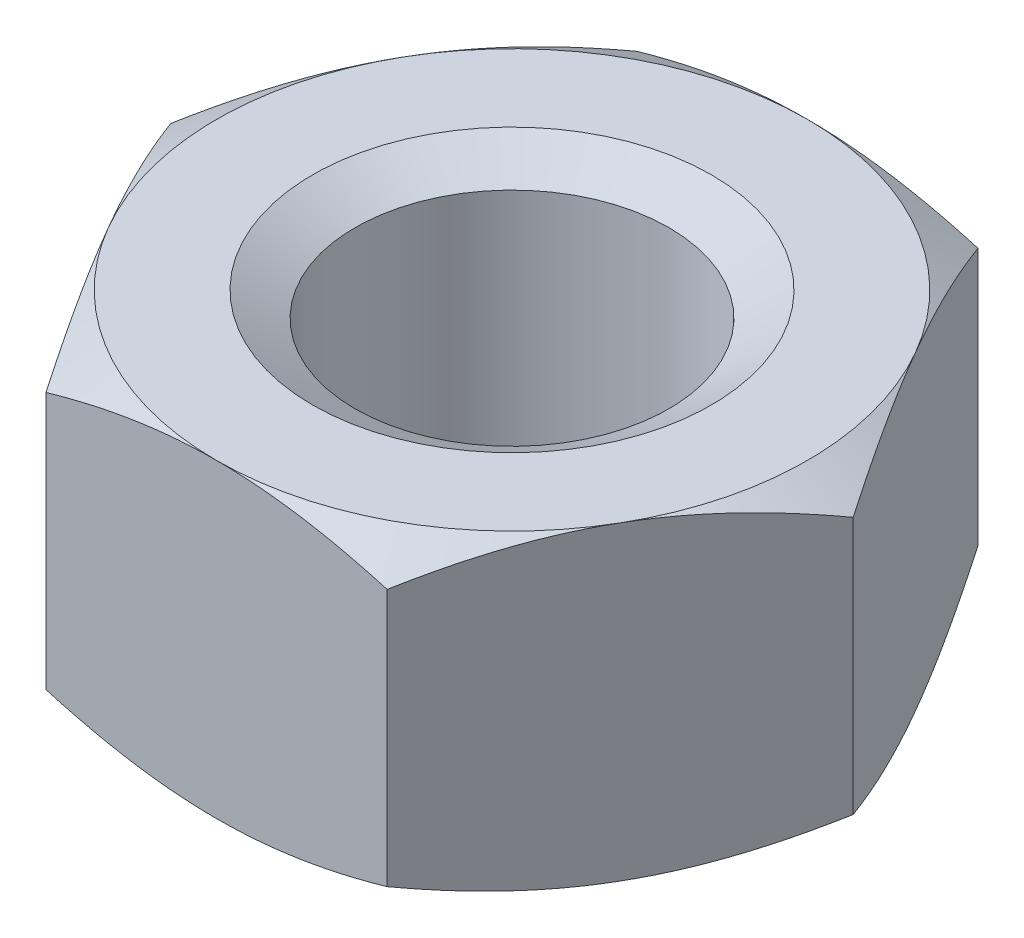
from build123d import *

# Parameters (mm, degrees)
VYSUNOUT1_DEPTH          = 4.2
SKICA3_R                 = 4.25
ODEBRAT_VYSUNUT_M1_DEPTH = 15.828800806


with BuildPart() as part:
    # Skica1 → Vysunout1 (new, symmetric)
    with BuildSketch(Plane(origin=(0, 0, 0), x_dir=(1, 0, 0), z_dir=(0, 1, 0))):
        Polygon((9.237604307, 0), (4.618802154, 8), (-4.618802154, 8), (-9.237604307, 0), (-4.618802154, -8), (4.618802154, -8), align=None)
    extrude(amount=VYSUNOUT1_DEPTH, both=True)

    # Skica2 → Odebrat otočením1 (revolve, cut)
    with BuildSketch(Plane(origin=(0, 0, 0), x_dir=(0, 0, -1), z_dir=(1, 0, 0))):
        Polygon((15.274613392, 4.2), (8, 4.2), (15.274613392, 0), align=None)
        Polygon((15.274613392, -4.2), (15.274613392, 0), (8, -4.2), align=None)
    revolve(axis=Axis((0, 4.2, 0), (0, -1, 0)), mode=Mode.SUBTRACT)

    # Skica3 → Odebrat vysunutím1 (cut, through all)
    with BuildSketch(Plane(origin=(0, 4.2, 0), x_dir=(-1, 0, 0), z_dir=(0, 1, 0))):
        with Locations(Location((0, 0, 0), (0, 0, 90))):
            Circle(SKICA3_R)
    extrude(amount=-ODEBRAT_VYSUNUT_M1_DEPTH, mode=Mode.SUBTRACT)

    # Odebrat vysunutím2 cone 1 section (through the dimple's axis) → Odebrat vysunutím2 (revolve, cut)
    with BuildSketch(Plane(origin=(0, 4.2, 0), x_dir=(0, 0, 1), z_dir=(1, 0, 0))):
        Polygon((0, 0), (5.4, 0), (0, 3.117691454), align=None)
    odebrat_vysunut_m2 = revolve(axis=Axis((0, 4.2, 0), (0, -1, 0)), mode=Mode.SUBTRACT)

    # Zrcadlit1: Odebrat vysunutím2 across plane
    add(odebrat_vysunut_m2.mirror(Plane.ZX), mode=Mode.SUBTRACT)


solid = part.part
